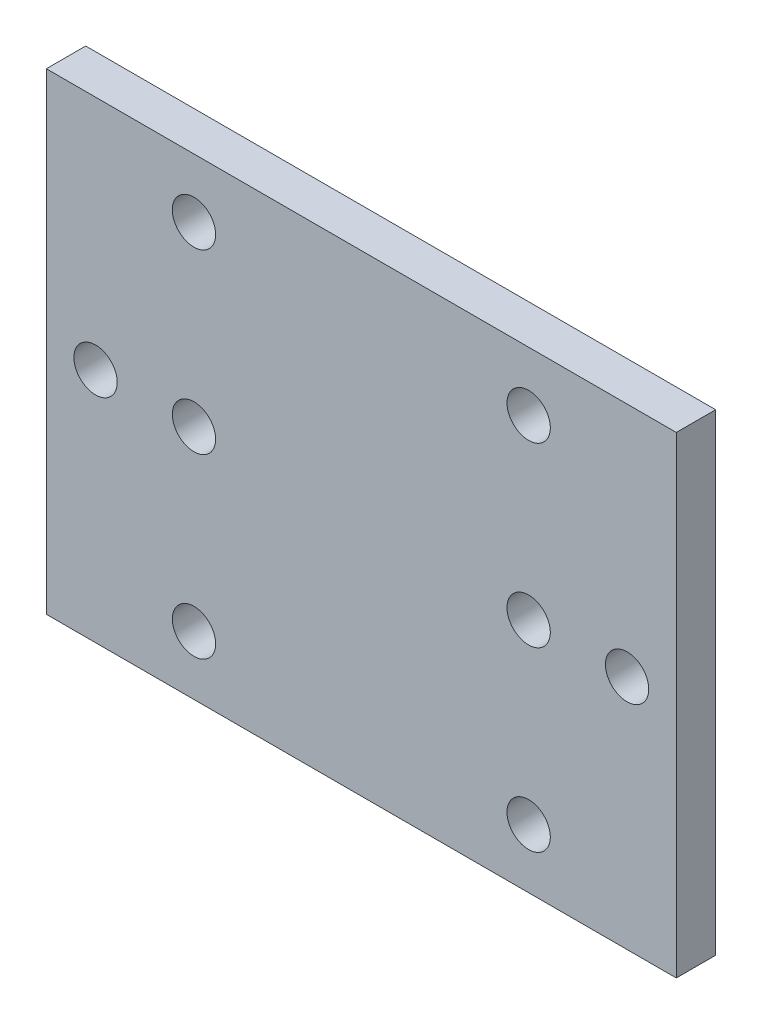
from build123d import *

# Parameters (mm, degrees)
SKETCH2_W           = 203.2
SKETCH2_H           = 152.4
BOSS_EXTRUDE1_DEPTH = 12.7
SKETCH3_R           = 6.985
CUT_EXTRUDE1_DEPTH  = 128.633420388


with BuildPart() as part:
    # Sketch2 → Boss-Extrude1 (new body)
    with BuildSketch(Plane.XY):
        Rectangle(SKETCH2_W, SKETCH2_H)
    extrude(amount=BOSS_EXTRUDE1_DEPTH)

    # Sketch3 → Cut-Extrude1 (cut, through all)
    with BuildSketch(Plane(origin=(0, 0, 0), x_dir=(-1, 0, 0), z_dir=(0, 0, -1))):
        with Locations((53.975, 0)):
            Circle(SKETCH3_R)
        with Locations((85.725, 0)):
            Circle(SKETCH3_R)
        with Locations((53.975, -57.15)):
            Circle(SKETCH3_R)
        with Locations((-53.975, 0)):
            Circle(SKETCH3_R)
        with Locations(Location((53.975, 57.15, 0), (0, 0, 180))):
            Circle(SKETCH3_R)
        with Locations((-53.975, -57.15)):
            Circle(SKETCH3_R)
        with Locations((-85.725, 0)):
            Circle(SKETCH3_R)
        with Locations((-53.975, 57.15)):
            Circle(SKETCH3_R)
    extrude(amount=-CUT_EXTRUDE1_DEPTH, mode=Mode.SUBTRACT)


solid = part.part
